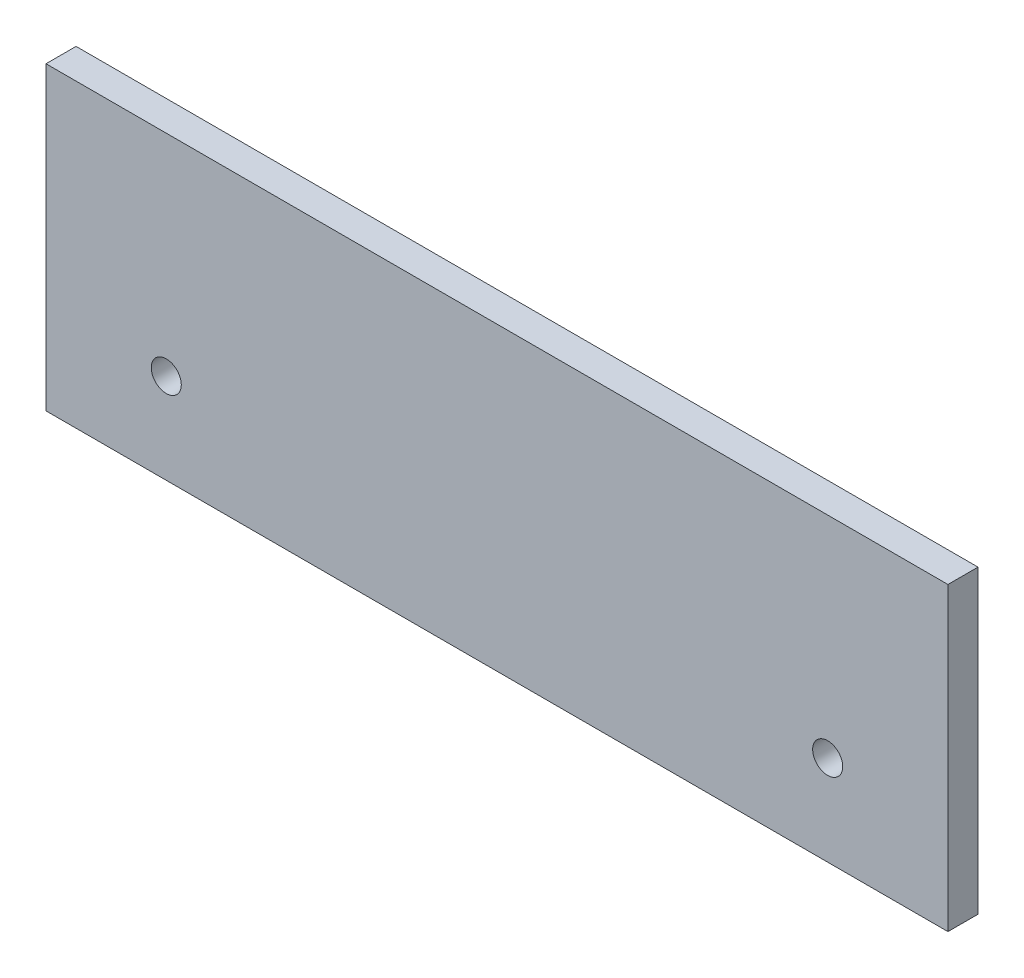
from build123d import *

# Parameters (mm, degrees)
ESQUISSE1_W             = 300
ESQUISSE1_H             = 100
BOSS_EXTRU_1_DEPTH      = 10
ESQUISSE2_R             = 5
ENL_V_MAT_EXTRU_1_DEPTH = 10


with BuildPart() as part:
    # Esquisse1 → Boss.-Extru.1 (new body)
    with BuildSketch(Plane.XY):
        with Locations((-32.77612873, -50)):
            Rectangle(ESQUISSE1_W, ESQUISSE1_H)
    extrude(amount=BOSS_EXTRU_1_DEPTH)

    # Esquisse2 → Enlèv. mat.-Extru.1 (cut)
    with BuildSketch(Plane.XY.offset(10)):
        with Locations((-142.77612873, -70)):
            Circle(ESQUISSE2_R)
        with Locations((77.22387127, -70)):
            Circle(ESQUISSE2_R)
    extrude(amount=-ENL_V_MAT_EXTRU_1_DEPTH, mode=Mode.SUBTRACT)


solid = part.part
